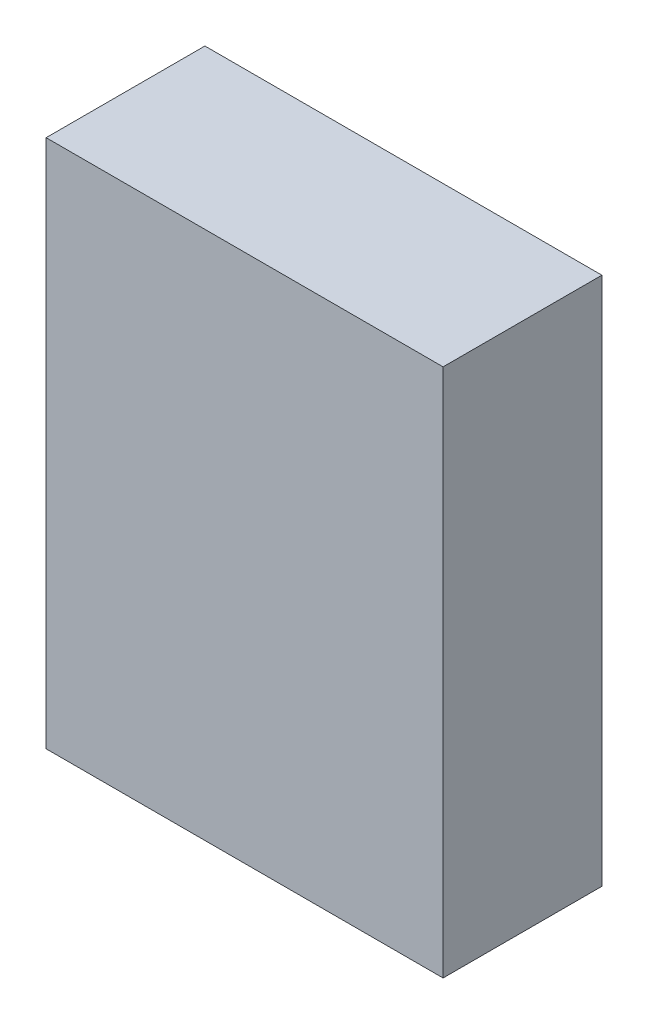
from build123d import *

# Parameters (mm, degrees)
SKETCH1_W           = 75
SKETCH1_H           = 100
BOSS_EXTRUDE1_DEPTH = 30


with BuildPart() as part:
    # Sketch1 → Boss-Extrude1 (new body)
    with BuildSketch(Plane.XY):
        Rectangle(SKETCH1_W, SKETCH1_H)
    extrude(amount=BOSS_EXTRUDE1_DEPTH)


solid = part.part
